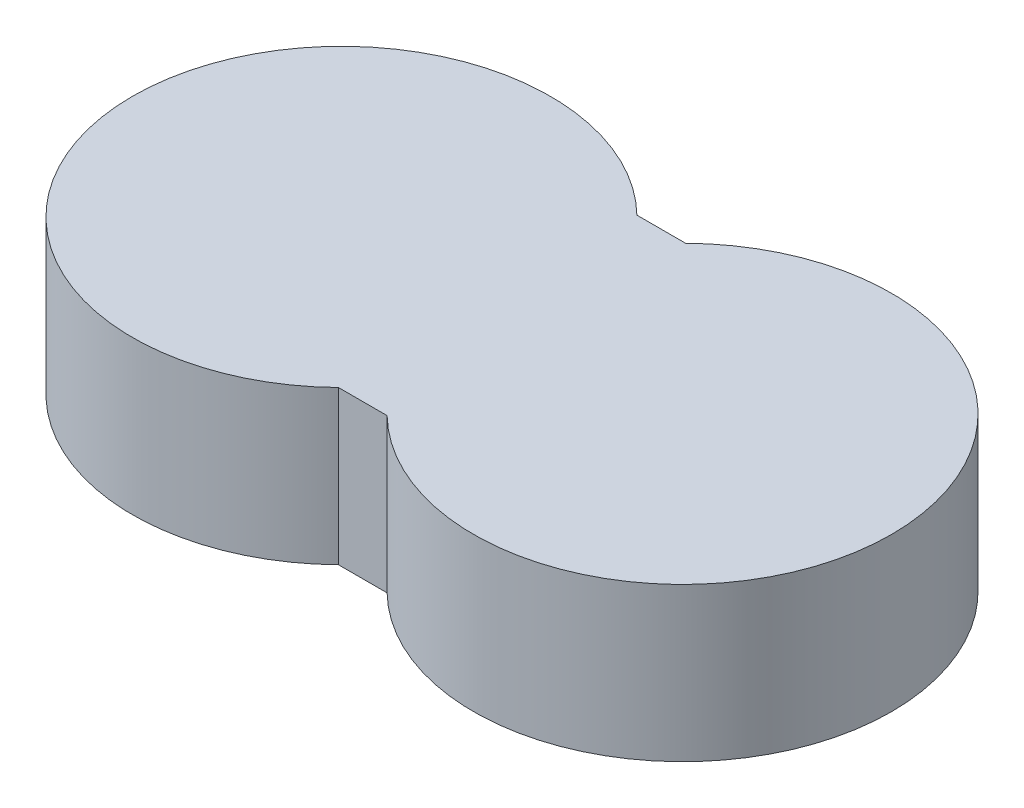
from build123d import *

# Parameters (mm, degrees)
EXTRUDE_1_DEPTH = 1.8


with BuildPart() as part:
    # 草图1 → 凸台-拉伸1 (new body)
    with BuildSketch(Plane(origin=(0, 0, 0), x_dir=(1, 0, 0), z_dir=(0, 1, 0))):
        with BuildLine():
            Line((-0.28535718, -1.75), (0.28535718, -1.75))
            ThreePointArc((0.28535718, -1.75), (4.45, 0), (0.28535718, 1.75))
            Line((0.28535718, 1.75), (-0.28535718, 1.75))
            ThreePointArc((-0.28535718, 1.75), (-4.45, 0), (-0.28535718, -1.75))
        make_face()
    extrude(amount=EXTRUDE_1_DEPTH)


solid = part.part
